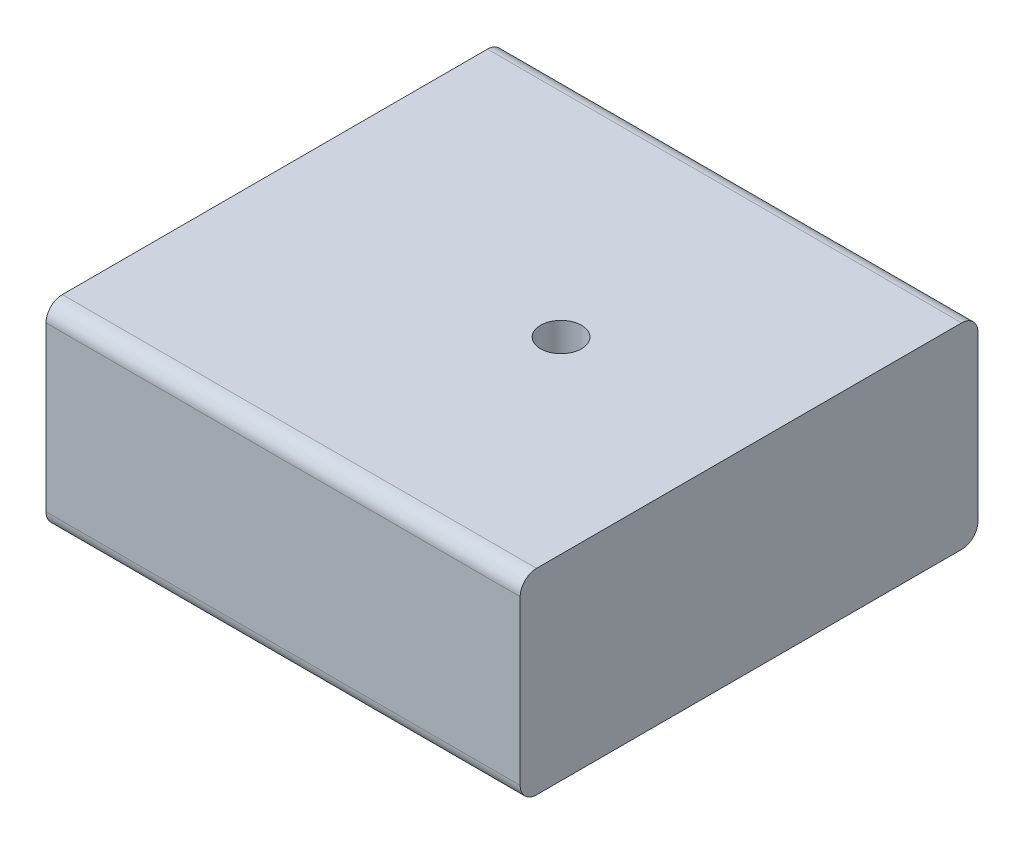
from build123d import *

# Parameters (mm, degrees)
SKETCH1_W                      = 92.075
SKETCH1_H                      = 38.1
BOSS_EXTRUDE1_DEPTH            = 88.9
FILLET1_R                      = 3.175
F_5_16_0_3125_DIAMETER_HOLE1_D = 7.9375


with BuildPart() as part:
    # Sketch1 → Boss-Extrude1 (new body)
    with BuildSketch(Plane.XY):
        with Locations((0, 19.05)):
            Rectangle(SKETCH1_W, SKETCH1_H)
    extrude(amount=BOSS_EXTRUDE1_DEPTH)

    # Fillet1
    fillet1_edges = [part.edges().sort_by_distance(p)[0] for p in [
        (0, 38.1, 88.9),
        (0, 38.1, 0),
        (0, 0, 0),
        (0, 0, 88.9),
    ]]
    fillet(fillet1_edges, radius=FILLET1_R)

    # 5/16 (0.3125) Diameter Hole1 (through all)
    with Locations(Plane(origin=(0, 38.1, 0), x_dir=(1, 0, 0), z_dir=(0, 1, 0))):
        with Locations((9.525, -44.45)):
            Hole(F_5_16_0_3125_DIAMETER_HOLE1_D / 2)


solid = part.part
